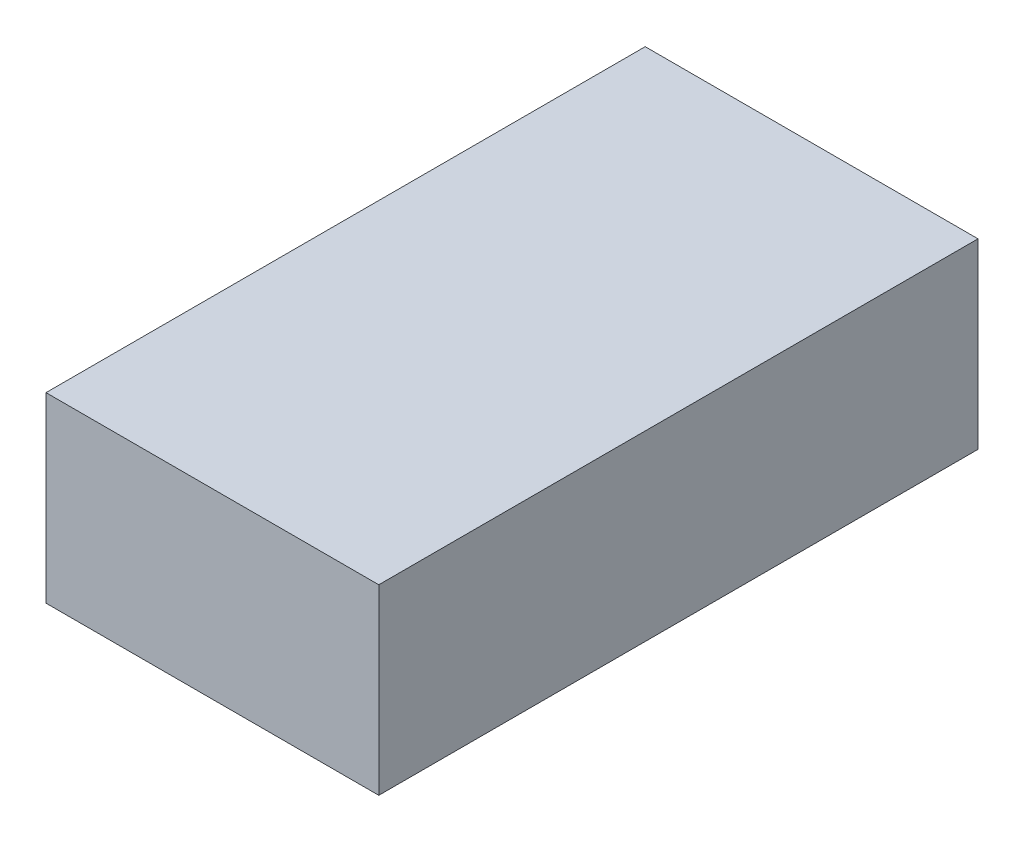
from build123d import *

# Parameters (mm, degrees)
CURVESKETCH_W   = 31.719
CURVESKETCH_H   = 17.381
CURVEBOSS_DEPTH = 57.113


with BuildPart() as part:
    # CurveSketch → CurveBoss (new body)
    with BuildSketch(Plane.XY):
        with Locations((-4.193, 6.827)):
            Rectangle(CURVESKETCH_W, CURVESKETCH_H)
    extrude(amount=CURVEBOSS_DEPTH)


solid = part.part
